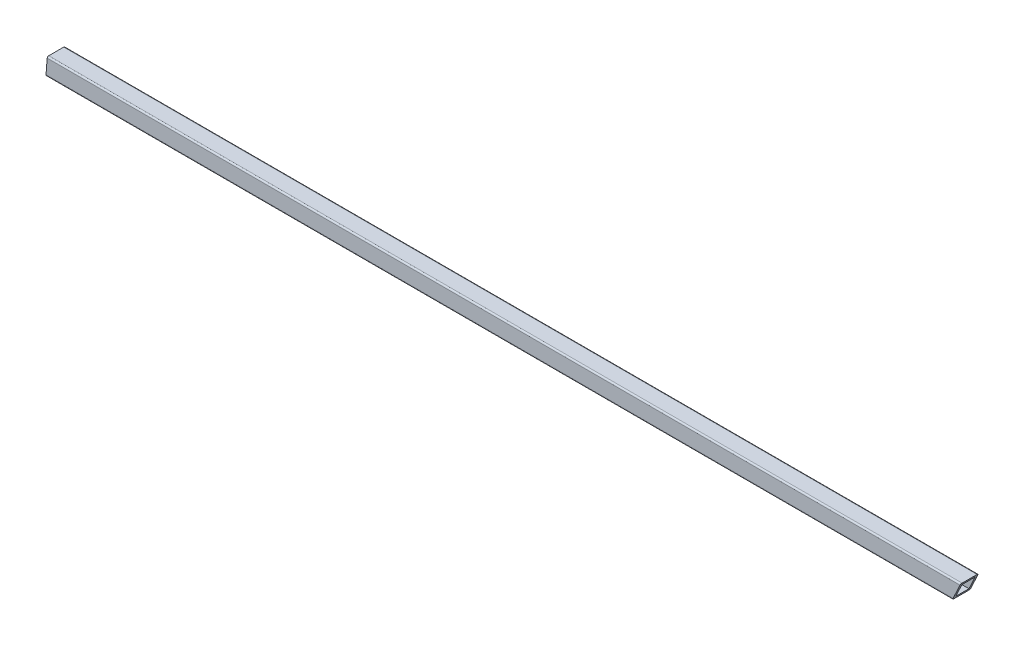
from build123d import *

# Parameters (mm, degrees)
SKETCH1_W           = 23.495
SKETCH1_H           = 23.495
BOSS_EXTRUDE1_DEPTH = 1320.8
SCALE4_SCALE_X      = 1
SCALE4_SCALE_Y      = 0.4
SCALE4_SCALE_Z      = 0.4
CUT_EXTRUDE1_DEPTH  = 1322.04802369


with BuildPart() as part:
    # Sketch1 → Boss-Extrude1 (new body)
    with BuildSketch(Plane(origin=(0, 0, 0), x_dir=(0, 0, -1), z_dir=(1, 0, 0))):
        with BuildLine():
            Line((0, 2.54), (0, 29.21))
            ThreePointArc((0, 29.21), (-0.743948776, 31.006051224), (-2.54, 31.75))
            Line((-2.54, 31.75), (-29.21, 31.75))
            ThreePointArc((-29.21, 31.75), (-31.006051224, 31.006051224), (-31.75, 29.21))
            Line((-31.75, 29.21), (-31.75, 2.54))
            ThreePointArc((-31.75, 2.54), (-31.006051224, 0.743948776), (-29.21, 0))
            Line((-29.21, 0), (-2.54, 0))
            ThreePointArc((-2.54, 0), (-0.743948776, 0.743948776), (0, 2.54))
        make_face()
        with Locations((-15.875, 15.875)):
            Rectangle(SKETCH1_W, SKETCH1_H, mode=Mode.SUBTRACT)
    extrude(amount=BOSS_EXTRUDE1_DEPTH)


with BuildPart() as part_1:
    # Scale4: scaled about (660.4, 15.875, 15.875)
    add(part.part.scale((SCALE4_SCALE_X, SCALE4_SCALE_Y, SCALE4_SCALE_Z), about=(660.4, 15.875, 15.875)))

    # Sketch3 → Cut-Extrude1 (cut, through all)
    with BuildSketch(Plane(origin=(0, 0, 9.525), x_dir=(-1, 0, 0), z_dir=(0, 0, -1))):
        Polygon((-1320.8, 22.225), (-1314.877892741, 9.525), (-1320.8, 9.525), align=None)
        Polygon((-670.100451899, 22.225), (-669.099476758, 9.525), (-619.573747082, 9.525), (-619.573747082, 22.225), align=None)
    extrude(amount=-CUT_EXTRUDE1_DEPTH, mode=Mode.SUBTRACT)


with BuildPart() as cut_extrude1_kept_piece:
    # of the separate pieces the step leaves, the one the design keeps (cut_extrude1_pieces_kept)
    add(part_1.part.solids().sort_by_distance((670.020373888, 21.209, 9.525))[0])


solid = cut_extrude1_kept_piece.part
